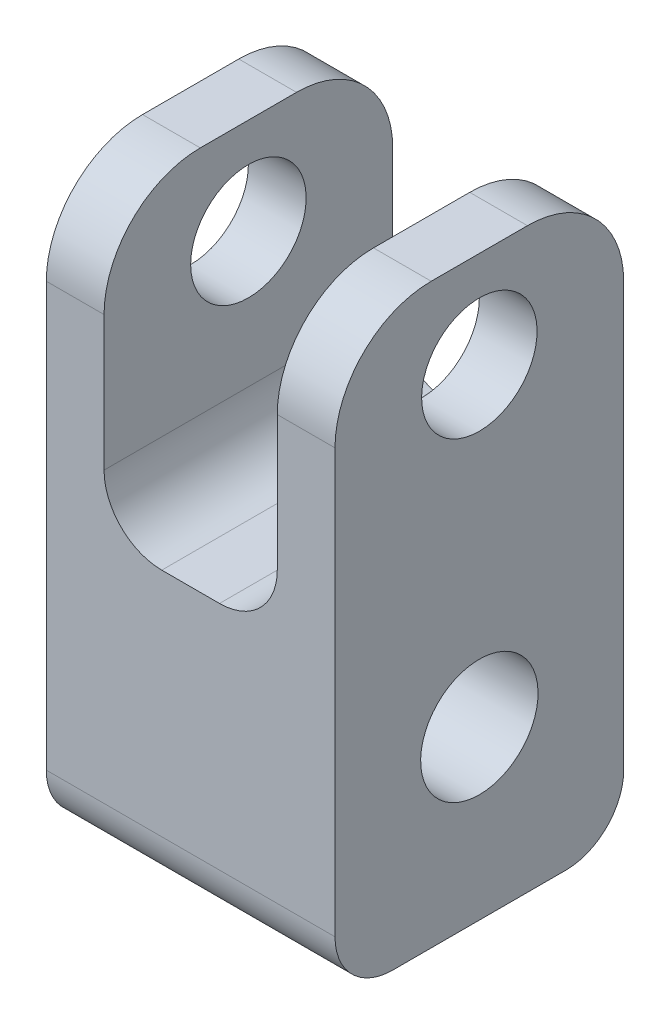
from build123d import *

# Parameters (mm, degrees)
SKETCH2_W           = 30
SKETCH2_H           = 30
BOSS_EXTRUDE2_DEPTH = 30
SKETCH4_W           = 6
SKETCH4_H           = 30
BOSS_EXTRUDE3_DEPTH = 30
FILLET4_R           = 10
SKETCH5_R           = 6
CUT_EXTRUDE1_DEPTH  = 30
FILLET5_R           = 6
SKETCH6_R           = 6.1
CUT_EXTRUDE2_DEPTH  = 62
FILLET6_R           = 6


with BuildPart() as part:
    # Sketch2 → Boss-Extrude2 (new body)
    with BuildSketch(Plane.XY):
        Rectangle(SKETCH2_W, SKETCH2_H)
    extrude(amount=BOSS_EXTRUDE2_DEPTH)

    # Sketch4 → Boss-Extrude3 (add)
    with BuildSketch(Plane(origin=(0, 15, 0), x_dir=(1, 0, 0), z_dir=(0, 1, 0))):
        with Locations((-12, -15)):
            Rectangle(SKETCH4_W, SKETCH4_H)
        with Locations((12, -15)):
            Rectangle(SKETCH4_W, SKETCH4_H)
    extrude(amount=BOSS_EXTRUDE3_DEPTH)

    # Fillet4
    fillet4_edges = [part.edges().sort_by_distance(p)[0] for p in [
        (-12, 45, 30),
        (-12, 45, 0),
        (12, 45, 30),
        (12, 45, 0),
    ]]
    fillet(fillet4_edges, radius=FILLET4_R)

    # Sketch5 → Cut-Extrude1 (cut)
    with BuildSketch(Plane.ZY.offset(15)):
        with Locations(Location((15, 35, 0), (0, 0, 270))):
            Circle(SKETCH5_R)
    extrude(amount=-CUT_EXTRUDE1_DEPTH, mode=Mode.SUBTRACT)

    # Fillet5
    fillet5_edges = [part.edges().sort_by_distance(p)[0] for p in [
        (-9, 15, 15),
        (9, 15, 15),
    ]]
    fillet(fillet5_edges, radius=FILLET5_R)

    # Sketch6 → Cut-Extrude2 (cut)
    with BuildSketch(Plane.ZY.offset(15)):
        with Locations(Location((15, 2.384259025, 0), (0, 0, 270))):
            Circle(SKETCH6_R)
    extrude(amount=-CUT_EXTRUDE2_DEPTH, mode=Mode.SUBTRACT)

    # Fillet6
    fillet6_edges = [part.edges().sort_by_distance(p)[0] for p in [
        (0, -15, 30),
        (0, -15, 0),
    ]]
    fillet(fillet6_edges, radius=FILLET6_R)


solid = part.part
